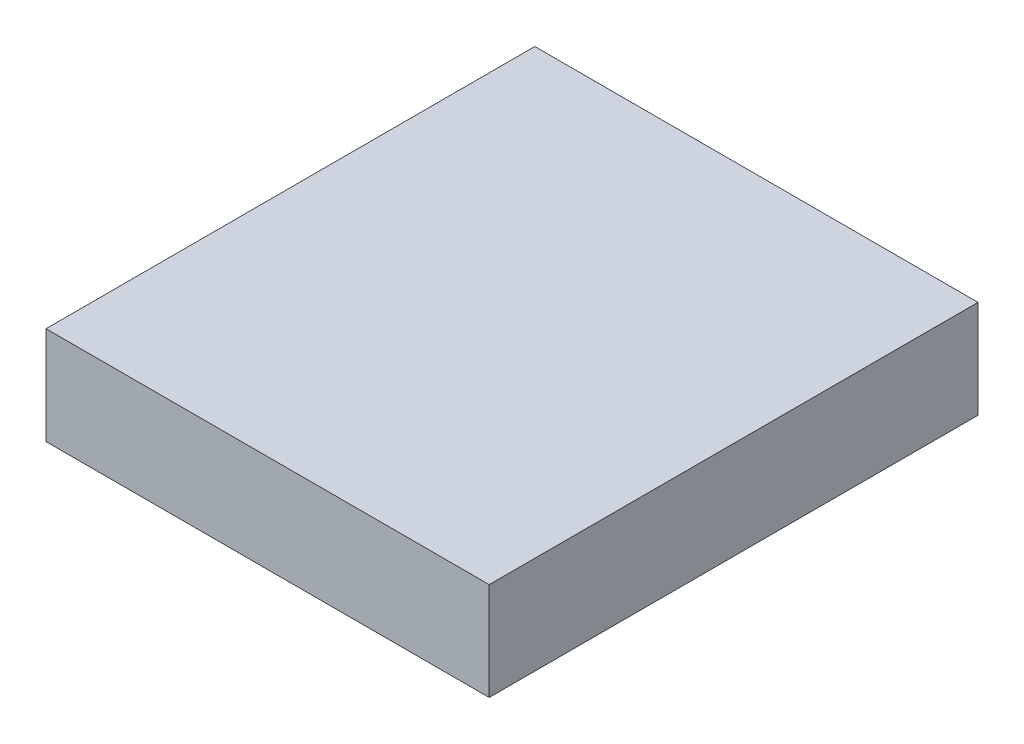
from build123d import *

# Parameters (mm, degrees)
SKETCH1_W           = 51.816
SKETCH1_H           = 57.15
BOSS_EXTRUDE1_DEPTH = 11.43


with BuildPart() as part:
    # Sketch1 → Boss-Extrude1 (new body)
    with BuildSketch(Plane(origin=(0, 0, 0), x_dir=(1, 0, 0), z_dir=(0, 1, 0))):
        Rectangle(SKETCH1_W, SKETCH1_H)
    extrude(amount=BOSS_EXTRUDE1_DEPTH)


solid = part.part
